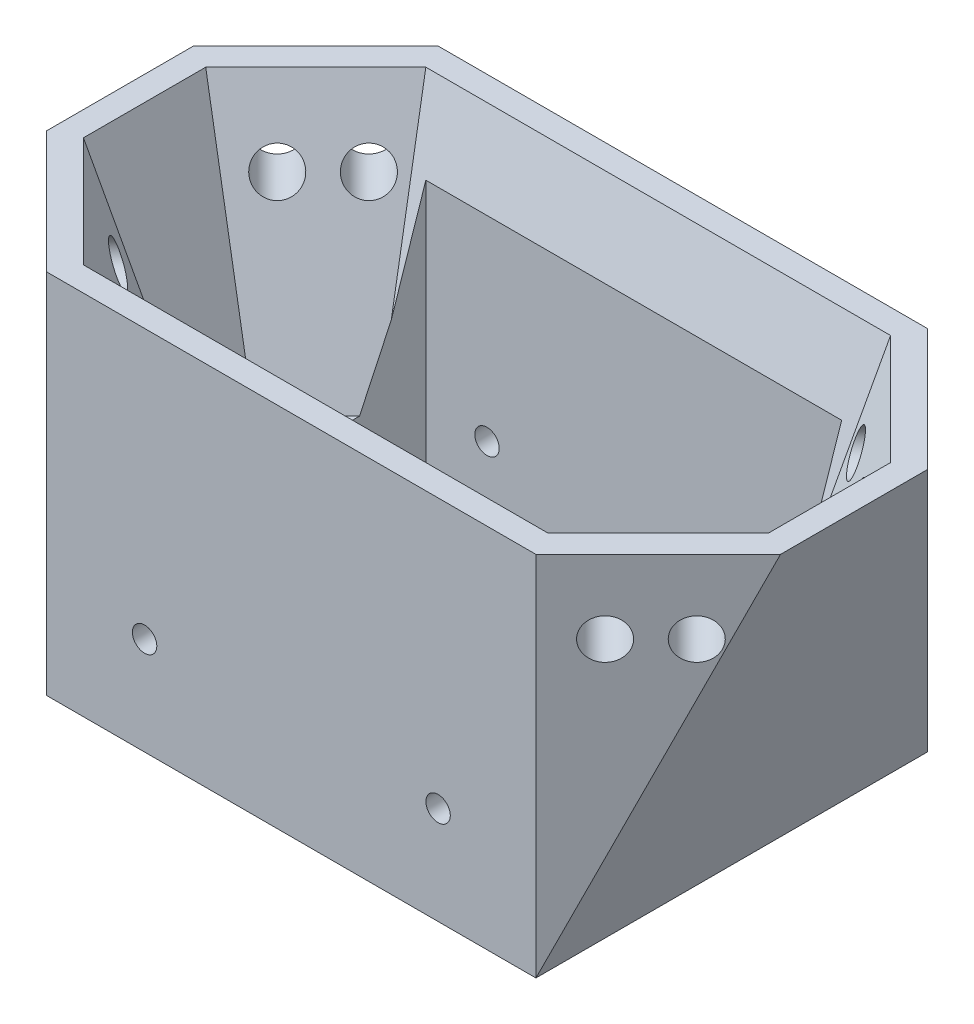
from build123d import *

# Parameters (mm, degrees)
BOSS_EXTRUDE1_DEPTH     = 150
CUT_EXTRUDE1_DEPTH      = 227.715680975
CUT_EXTRUDE1_DEPTH_BACK = 227.715680975
SKETCH3_W               = 170
SKETCH3_H               = 190
CUT_EXTRUDE2_DEPTH      = 60
CUT_EXTRUDE3_DEPTH      = 100
CUT_EXTRUDE3_DRAFT      = -18.43
SKETCH5_R               = 8.25
CUT_EXTRUDE4_DEPTH      = 80
MIRROR2_COPY_1_SKETCH_R = 8.25
MIRROR2_COPY_1_DEPTH    = 80
SKETCH7_R               = 5
CUT_EXTRUDE5_DEPTH      = 266.706605112


with BuildPart() as part:
    # Sketch1 → Boss-Extrude1 (new body)
    with BuildSketch(Plane(origin=(0, 0, 0), x_dir=(1, 0, 0), z_dir=(0, 1, 0))):
        Polygon((-150, 30), (-100, 80), (100, 80), (150, 30), (150, -30), (100, -80), (-100, -80), (-150, -30), align=None)
    extrude(amount=BOSS_EXTRUDE1_DEPTH)

    # Sketch2 → Cut-Extrude1 (cut, two sides: drawn at the far end of the back side and taken through both)
    with BuildSketch(Plane.XY.offset(-CUT_EXTRUDE1_DEPTH_BACK)):
        Polygon((-150, 150), (-100, 0), (-150, 0), align=None)
        Polygon((100, 0), (150, 150), (150, 0), align=None)
    extrude(amount=CUT_EXTRUDE1_DEPTH + CUT_EXTRUDE1_DEPTH_BACK, mode=Mode.SUBTRACT)

    # Sketch3 → Cut-Extrude2 (cut, symmetric)
    with BuildSketch(Plane.XY):
        with Locations((0, 105)):
            Rectangle(SKETCH3_W, SKETCH3_H)
    extrude(amount=CUT_EXTRUDE2_DEPTH, both=True, mode=Mode.SUBTRACT)


with BuildPart() as cut_extrude3_tool:
    # Sketch4 → Cut-Extrude3 (with draft: the straight prism first)
    with BuildSketch(Plane(origin=(0, 150, 0), x_dir=(1, 0, 0), z_dir=(0, 1, 0))):
        Polygon((-140, -25), (-125, -40), (-95, -70), (95, -70), (140, -25), (140, 25), (95, 70), (-95, 70), (-140, 25), align=None)
    extrude(amount=-CUT_EXTRUDE3_DEPTH)
    # Cut-Extrude3: the draft: its side faces are tilted about the plane it starts from
    cut_extrude3_sides = [cut_extrude3_tool.faces().sort_by_distance(p)[0] for p in [
        (-117.5, 100, 47.5),
        (-117.5, 100, -47.5),
        (0, 100, -70),
        (117.5, 100, -47.5),
        (140, 100, 0),
        (117.5, 100, 47.5),
        (0, 100, 70),
        (-140, 100, 0),
    ]]
    draft(cut_extrude3_sides, Plane(origin=(0, 150, 0), x_dir=(1, 0, 0), z_dir=(0, 1, 0)), CUT_EXTRUDE3_DRAFT)


with BuildPart() as part_1:
    add(part.part)

    # Cut-Extrude3: cut by cut_extrude3_tool
    add(cut_extrude3_tool.part, mode=Mode.SUBTRACT)

    # Sketch5 → Cut-Extrude4 (cut)
    with BuildSketch(Plane(origin=(-90, 0, 90), x_dir=(0.7071067811865475, 0, 0.7071067811865477), z_dir=(-0.7071067811865477, 0, 0.7071067811865475))):
        with Locations((-60.642135624, 120)):
            Circle(SKETCH5_R)
        with Locations((-34.142135624, 120)):
            Circle(SKETCH5_R)
    cut_extrude4 = extrude(amount=-CUT_EXTRUDE4_DEPTH, mode=Mode.SUBTRACT)

    # Mirror1: Cut-Extrude4 across plane
    add(cut_extrude4.mirror(Plane.XY), mode=Mode.SUBTRACT)

    # Mirror2: Cut-Extrude4 across plane
    add(cut_extrude4.mirror(Plane(origin=(0, 0, 0), x_dir=(0, 0, 1), z_dir=(1, 0, 0))), mode=Mode.SUBTRACT)

    # Mirror2 copy 1 sketch → Mirror2 copy 1 (cut)
    with BuildSketch(Plane(origin=(90, 0, -90), x_dir=(-0.7071067811865475, 0, -0.7071067811865477), z_dir=(0.7071067811865477, 0, -0.7071067811865475))):
        with Locations((-60.642135624, 120)):
            Circle(MIRROR2_COPY_1_SKETCH_R)
        with Locations((-34.142135624, 120)):
            Circle(MIRROR2_COPY_1_SKETCH_R)
    extrude(amount=-MIRROR2_COPY_1_DEPTH, mode=Mode.SUBTRACT)

    # Sketch7 → Cut-Extrude5 (cut, through all)
    with BuildSketch(Plane.XY.offset(80)):
        with Locations((-60, 40)):
            Circle(SKETCH7_R)
        with Locations((60, 40)):
            Circle(SKETCH7_R)
    extrude(amount=-CUT_EXTRUDE5_DEPTH, mode=Mode.SUBTRACT)


solid = part_1.part
